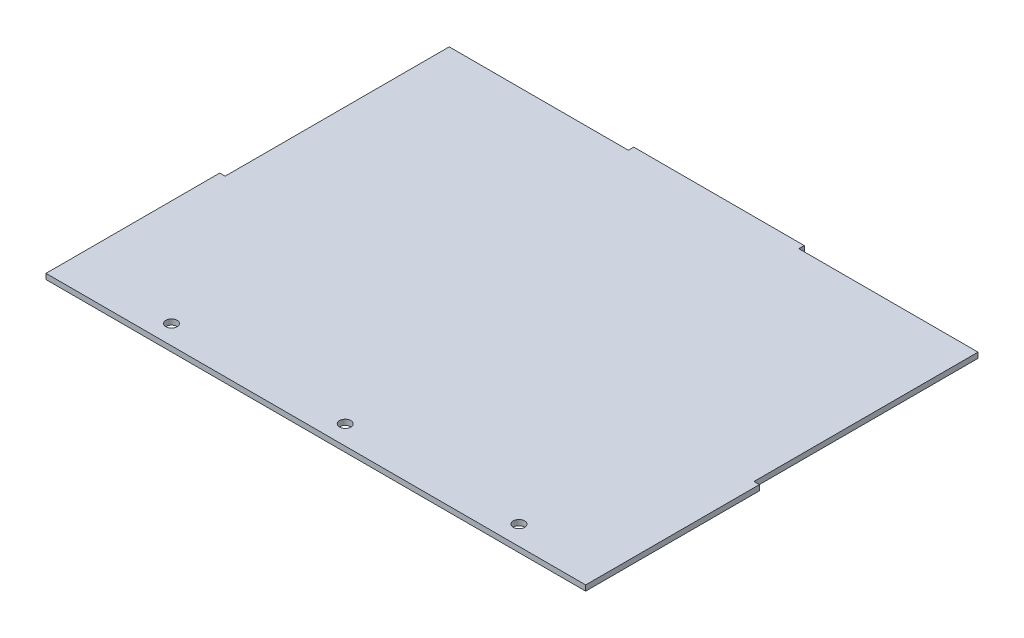
from build123d import *

# Parameters (mm, degrees)
SKETCH1_W           = 315.58
SKETCH1_H           = 3.175
BOSS_EXTRUDE1_DEPTH = 232.600000128
SKETCH5_W           = 3.175
SKETCH5_H           = 130.999992
CUT_EXTRUDE2_DEPTH  = 282.088108579
SKETCH7_R           = 3.302
CUT_EXTRUDE3_DEPTH  = 282.088108579
LPATTERN1_COUNT     = 3
LPATTERN1_PITCH     = 101.6
SKETCH10_W          = 99.68
SKETCH10_H          = 3.175
BOSS_EXTRUDE2_DEPTH = 3.175


with BuildPart() as part:
    # Sketch1 → Boss-Extrude1 (new body)
    with BuildSketch(Plane.XY):
        Rectangle(SKETCH1_W, SKETCH1_H)
    extrude(amount=BOSS_EXTRUDE1_DEPTH)

    # Sketch5 → Cut-Extrude2 (cut, symmetric)
    with BuildSketch(Plane(origin=(0, 1.5875, 0), x_dir=(1, 0, 0), z_dir=(0, 1, 0))):
        with Locations((-156.2025, -65.499996)):
            Rectangle(SKETCH5_W, SKETCH5_H)
    cut_extrude2 = extrude(amount=CUT_EXTRUDE2_DEPTH, both=True, mode=Mode.SUBTRACT)

    # Mirror1: Cut-Extrude2 across plane
    add(cut_extrude2.mirror(Plane(origin=(0, 0, 0), x_dir=(0, 0, 1), z_dir=(1, 0, 0))), mode=Mode.SUBTRACT)

    # Sketch7 → Cut-Extrude3 (cut, through all)
    with BuildSketch(Plane.XZ.offset(1.5875)):
        with Locations(Location((107.495393219, 221.30835, 0), (0, 0, 270))):
            Circle(SKETCH7_R)
    cut_extrude3 = extrude(amount=-CUT_EXTRUDE3_DEPTH, mode=Mode.SUBTRACT)

    # LPattern1: Cut-Extrude3 ×3
    with Locations(*[(-i * LPATTERN1_PITCH, 0, 0) for i in range(1, LPATTERN1_COUNT)]):
        add(cut_extrude3, mode=Mode.SUBTRACT)

    # Sketch10 → Boss-Extrude2 (add)
    with BuildSketch(Plane(origin=(0, 0, 0), x_dir=(-1, 0, 0), z_dir=(0, 0, -1))):
        Rectangle(SKETCH10_W, SKETCH10_H)
    extrude(amount=BOSS_EXTRUDE2_DEPTH)


solid = part.part
